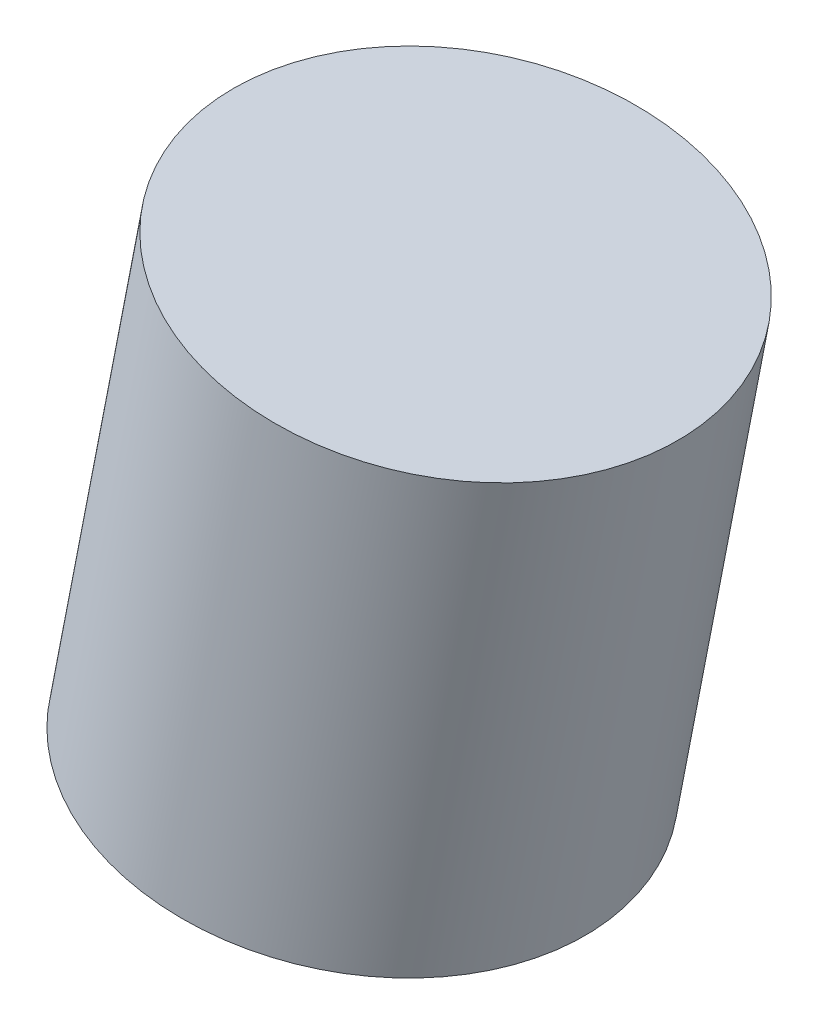
from build123d import *

# Parameters (mm, degrees)
SKETCH_3_R      = 7.5
EXTRUDE_1_DEPTH = 16


with BuildPart() as part:
    # 草图3 → 凸台-拉伸1 (new body)
    with BuildSketch(Plane(origin=(-12.137840646, -63.73733646, 0.400469163), x_dir=(-0.9772888334706439, 0.18546622246719147, -0.10251251775923895), z_dir=(0.18706980982149188, 0.9823272325023449, -0.006172077254473404))):
        with Locations(Location((-25, -30, 0), (0, 0, 5.883983356))):
            Circle(SKETCH_3_R)
    extrude(amount=EXTRUDE_1_DEPTH)


solid = part.part
